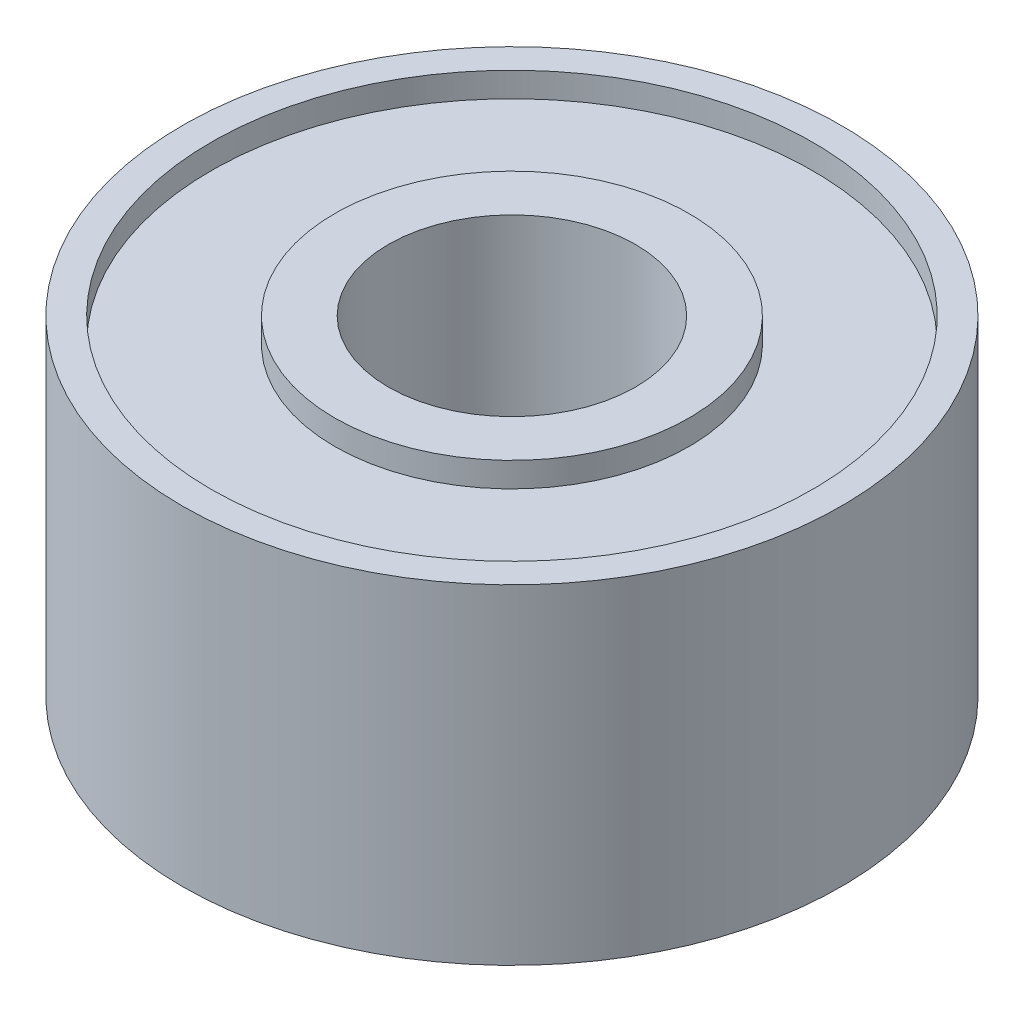
from build123d import *

# Parameters (mm, degrees)
SKETCH1_R              = 4
SKETCH1_R_2            = 1.5
BASE_SIZE_DEPTH        = 4
SKETCH2_R              = 3.65
SKETCH2_R_2            = 2.15
BEARING_FEATURES_DEPTH = 0.3


with BuildPart() as part:
    # Sketch1 → Base size (new body)
    with BuildSketch(Plane(origin=(0, 0, 0), x_dir=(1, 0, 0), z_dir=(0, 1, 0))):
        with Locations(Location((0, 0, 0), (0, 0, 270))):
            Circle(SKETCH1_R)
        with Locations(Location((0, 0, 0), (0, 0, 270))):
            Circle(SKETCH1_R_2, mode=Mode.SUBTRACT)
    extrude(amount=BASE_SIZE_DEPTH)

    # Sketch2 → Bearing features (cut)
    with BuildSketch(Plane(origin=(0, 4, 0), x_dir=(1, 0, 0), z_dir=(0, 1, 0))):
        with Locations(Location((0, 0, 0), (0, 0, 270))):
            Circle(SKETCH2_R)
        with Locations(Location((0, 0, 0), (0, 0, 270))):
            Circle(SKETCH2_R_2, mode=Mode.SUBTRACT)
    bearing_features = extrude(amount=-BEARING_FEATURES_DEPTH, mode=Mode.SUBTRACT)

    # Mirror1: Bearing features across plane
    add(bearing_features.mirror(Plane.ZX.offset(2)), mode=Mode.SUBTRACT)


solid = part.part
